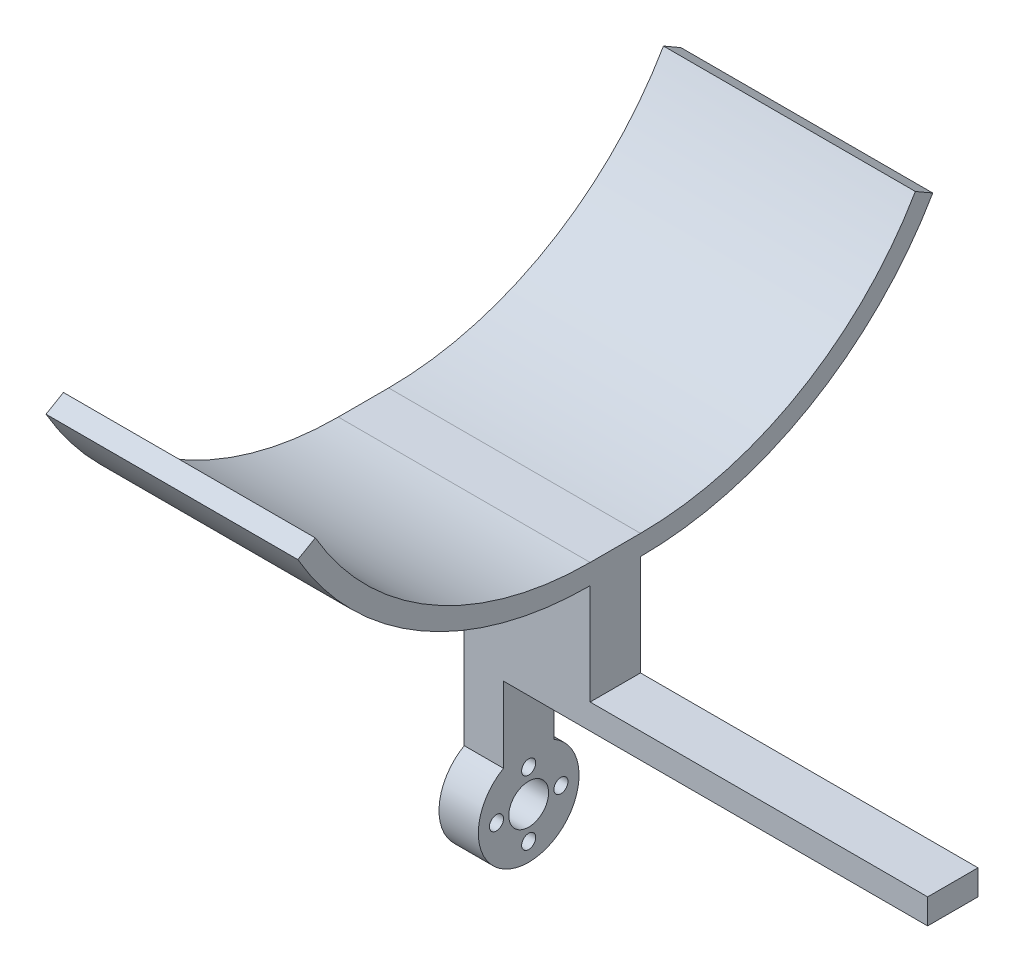
from build123d import *

# Parameters (mm, degrees)
SKETCH1_R                = 5.0165
SKETCH1_R_2              = 1.778
BOSS_EXTRUDE1_DEPTH      = 9.906
BOSS_EXTRUDE2_DEPTH      = 31.75
BOSS_EXTRUDE2_DEPTH_BACK = 31.75
BOSS_EXTRUDE3_START      = -9.906
SKETCH4_W                = 12.7
SKETCH4_H                = 6.35
BOSS_EXTRUDE3_DEPTH      = 106.934
BOSS_EXTRUDE4_START      = -41.656
SKETCH5_W                = 12.7
SKETCH5_H                = 25.4
BOSS_EXTRUDE4_DEPTH      = 63.5


with BuildPart() as part:
    # Sketch1 → Boss-Extrude1 (new body)
    with BuildSketch(Plane(origin=(0, 0, 0), x_dir=(0, 0, -1), z_dir=(1, 0, 0))):
        with BuildLine():
            Line((-6.35, 10.998522628), (-6.35, 61.798522628))
            Line((-6.35, 61.798522628), (6.35, 61.798522628))
            Line((6.35, 61.798522628), (6.35, 10.998522628))
            ThreePointArc((6.35, 10.998522628), (0, -12.7), (-6.35, 10.998522628))
        make_face()
        Circle(SKETCH1_R, mode=Mode.SUBTRACT)
        with Locations((-8.128, 0)):
            Circle(SKETCH1_R_2, mode=Mode.SUBTRACT)
        with Locations((8.128, 0)):
            Circle(SKETCH1_R_2, mode=Mode.SUBTRACT)
        with Locations((0, -8.128)):
            Circle(SKETCH1_R_2, mode=Mode.SUBTRACT)
        with Locations((0, 8.128)):
            Circle(SKETCH1_R_2, mode=Mode.SUBTRACT)
    extrude(amount=BOSS_EXTRUDE1_DEPTH)

    # Sketch3 → Boss-Extrude2 (add, two sides: drawn at the far end of the back side and taken through both)
    with BuildSketch(Plane(origin=(0, 0, 0), x_dir=(0, 0, -1), z_dir=(1, 0, 0)).offset(-BOSS_EXTRUDE2_DEPTH_BACK)):
        with BuildLine():
            Line((-80.040101608, 104.343522628), (-75.640692557, 106.883522628))
            ThreePointArc((-75.640692557, 106.883522628), (-46.355, 77.597830071), (-6.35, 66.878522628))
            Line((-6.35, 66.878522628), (6.35, 66.878522628))
            ThreePointArc((6.35, 66.878522628), (46.355, 77.597830071), (75.640692557, 106.883522628))
            Line((75.640692557, 106.883522628), (80.040101608, 104.343522628))
            ThreePointArc((80.040101608, 104.343522628), (48.895, 73.19842102), (6.35, 61.798522628))
            Line((6.35, 61.798522628), (-6.35, 61.798522628))
            ThreePointArc((-6.35, 61.798522628), (-48.895, 73.19842102), (-80.040101608, 104.343522628))
        make_face()
    extrude(amount=BOSS_EXTRUDE2_DEPTH + BOSS_EXTRUDE2_DEPTH_BACK)

    # Sketch4 → Boss-Extrude3 (add)
    with BuildSketch(Plane.ZY.offset(BOSS_EXTRUDE3_START)):
        with Locations((0, 33.223522628)):
            Rectangle(SKETCH4_W, SKETCH4_H)
    extrude(amount=-BOSS_EXTRUDE3_DEPTH)

    # Sketch5 → Boss-Extrude4 (add)
    with BuildSketch(Plane(origin=(9.906, 0, 0), x_dir=(0, 0, -1), z_dir=(1, 0, 0)).offset(BOSS_EXTRUDE4_START)):
        with Locations((0, 49.098522628)):
            Rectangle(SKETCH5_W, SKETCH5_H)
    extrude(amount=BOSS_EXTRUDE4_DEPTH)


solid = part.part
